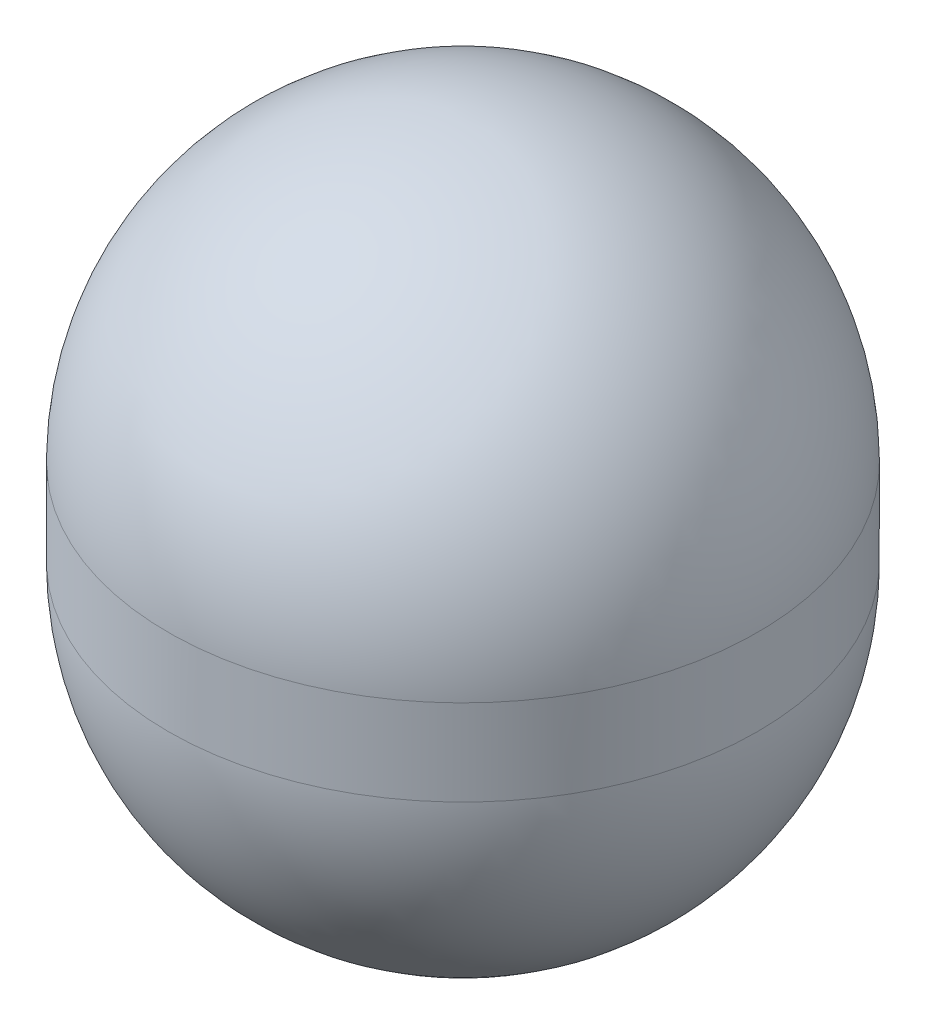
from build123d import *
from build123d.topology import SkipClean

# Parameters (mm, degrees)
REVOLVE1_ANGLE = 180


with BuildPart() as part:
    # Revolve Profile → Revolve1 (revolve)
    with BuildSketch(Plane.XY):
        with BuildLine():
            Line((0, -0.275), (0, 0.275))
            ThreePointArc((0, 0.275), (-0.169705627, 0.204705627), (-0.24, 0.035))
            Line((-0.24, 0.035), (-0.24, -0.035))
            ThreePointArc((-0.24, -0.035), (-0.169705627, -0.204705627), (0, -0.275))
        make_face()
    revolve(axis=Axis((0, 0, 0), (0, -1, 0)), revolution_arc=REVOLVE1_ANGLE)

    # Mirror1: part across plane


with BuildPart() as part_1:
    with SkipClean():  # the faces are left unmerged after this step: merging them gives an invalid solid
        add(part.part)
        add(part.part.mirror(Plane.XY))


solid = part_1.part
